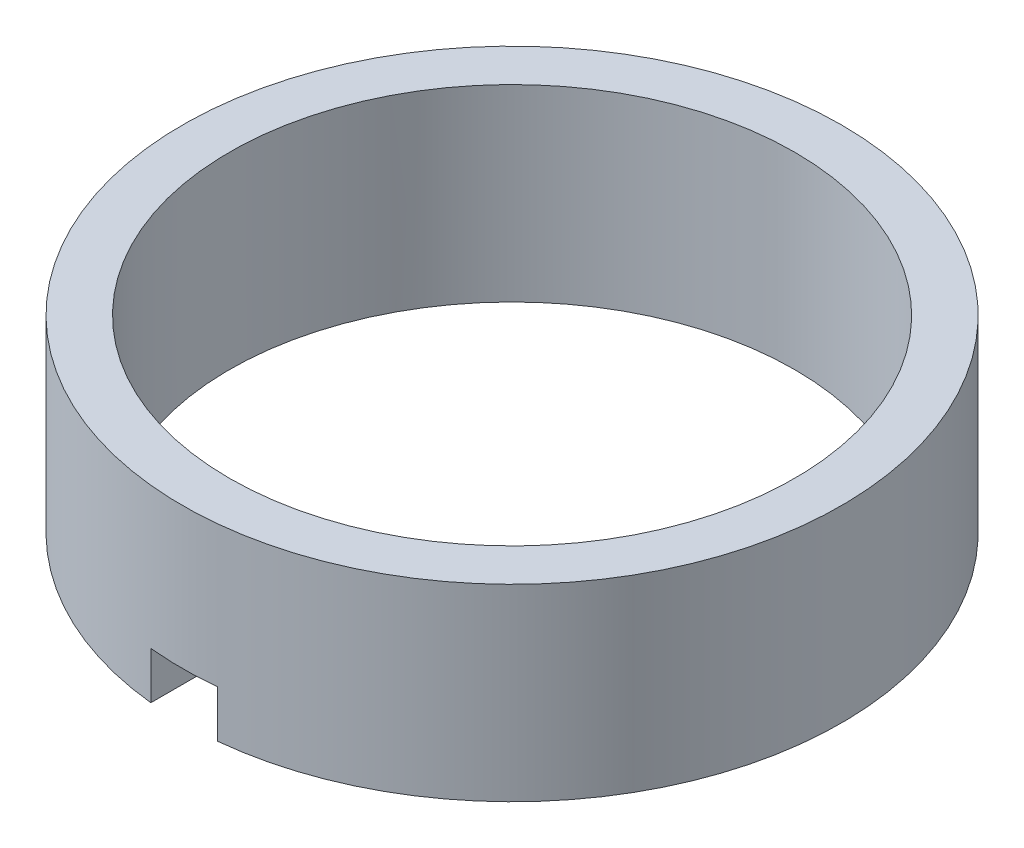
from build123d import *

# Parameters (mm, degrees)
SKETCH1_W          = 76.2
SKETCH1_H          = 19.0246
CUT_EXTRUDE2_START = -38.1
SKETCH2_W          = 26.9748
SKETCH2_H          = 266.7
CUT_EXTRUDE2_DEPTH = 19.05


with BuildPart() as part:
    # Sketch1 → Revolve1 (revolve)
    with BuildSketch(Plane(origin=(0, 0, 0), x_dir=(0, 1, 0), z_dir=(0, 0, 1)), mode=Mode.PRIVATE) as revolve1_sk:
        with Locations((0, 123.8377)):
            Rectangle(SKETCH1_W, SKETCH1_H)
    revolve(revolve1_sk.sketch.rotate(Axis((0, -63.5, 0), (0, 1, 0)), 270), axis=Axis((0, -63.5, 0), (0, 1, 0)))

    # Sketch2 → Cut-Extrude2 (cut)
    with BuildSketch(Plane(origin=(0, 0, 0), x_dir=(-1, 0, 0), z_dir=(0, 1, 0)).offset(CUT_EXTRUDE2_START)):
        with Locations((0, 133.35)):
            Rectangle(SKETCH2_W, SKETCH2_H)
    extrude(amount=CUT_EXTRUDE2_DEPTH, mode=Mode.SUBTRACT)


solid = part.part
